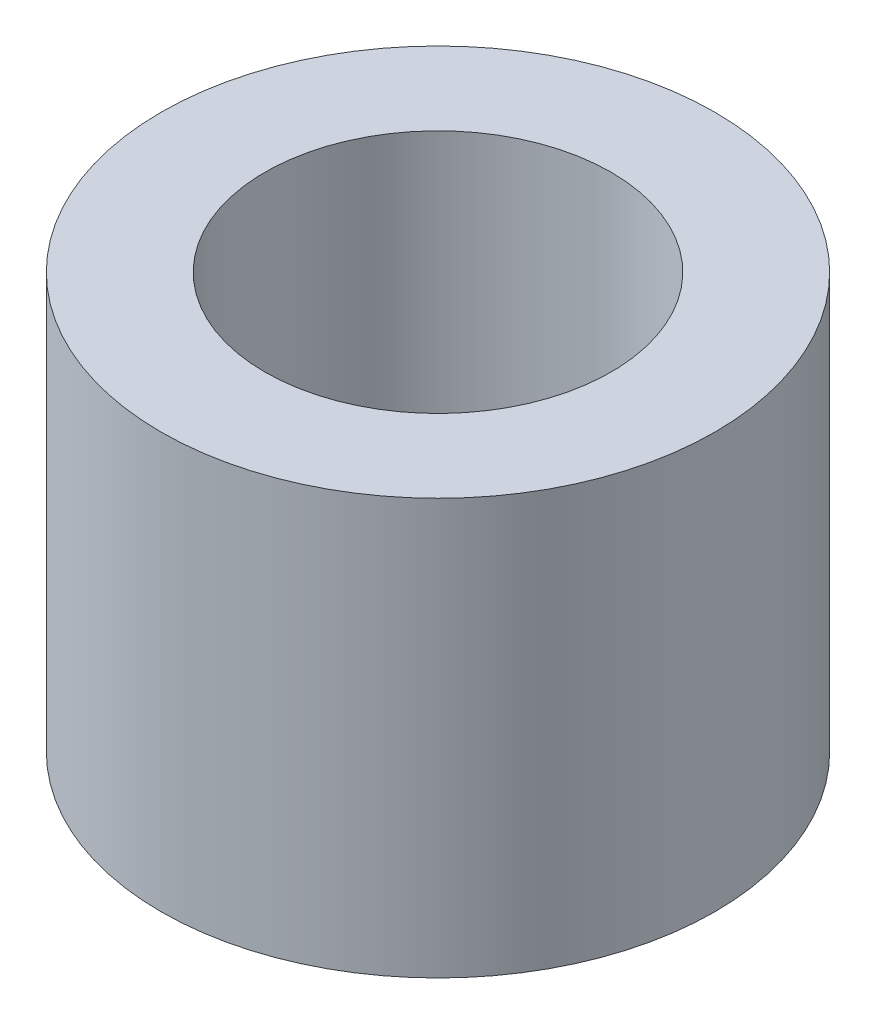
from build123d import *

# Parameters (mm, degrees)
SKETCH1_R           = 4
SKETCH1_R_2         = 2.5
BOSS_EXTRUDE1_DEPTH = 6


with BuildPart() as part:
    # Sketch1 → Boss-Extrude1 (new body)
    with BuildSketch(Plane(origin=(0, 0, 0), x_dir=(1, 0, 0), z_dir=(0, 1, 0))):
        with Locations(Location((0, 0, 0), (0, 0, 270))):
            Circle(SKETCH1_R)
        with Locations(Location((0, 0, 0), (0, 0, 270))):
            Circle(SKETCH1_R_2, mode=Mode.SUBTRACT)
    extrude(amount=BOSS_EXTRUDE1_DEPTH)


solid = part.part
